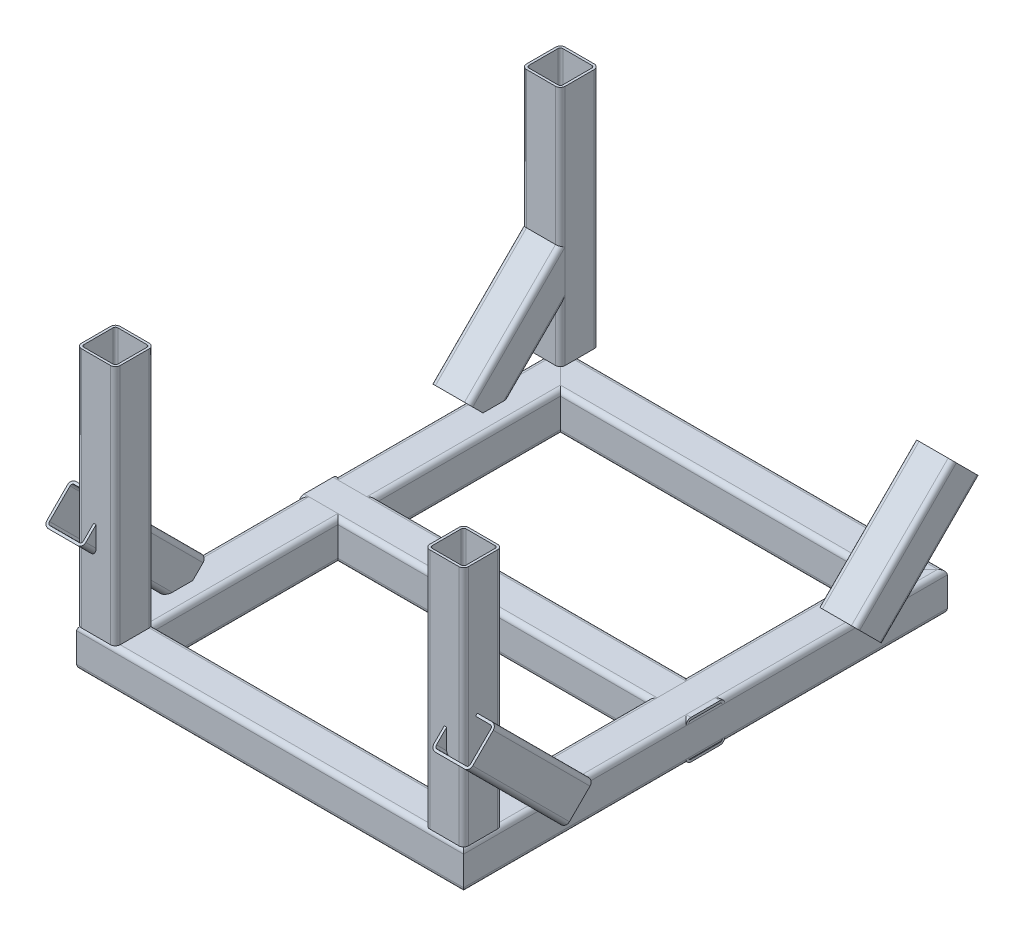
from build123d import *

# Parameters (mm, degrees)
SQUARE_TUBE_80_X_80_X_5_1_DEPTH      = 1114.13708499
SQUARE_TUBE_80_X_80_X_5_1_DEPTH_BACK = 114.13708499
SQUARE_TUBE_80_X_80_X_5_1_2_DEPTH    = 1028.27416998
SQUARE_TUBE_80_X_80_X_5_1_3_DEPTH    = 1228.27416998
SQUARE_TUBE_80_X_80_X_5_1_4_DEPTH    = 1028.27416998
SQUARE_TUBE_80_X_80_X_5_2_DEPTH      = 800
SQUARE_TUBE_80_X_80_X_5_3_DEPTH      = 500
SQUARE_TUBE_80_X_80_X_5_8_DEPTH      = 282.842712475
SQUARE_TUBE_80_X_80_X_5_8_2_DEPTH    = 282.842712475
SQUARE_TUBE_80_X_80_X_5_8_3_DEPTH    = 282.842712475
SQUARE_TUBE_80_X_80_X_5_8_4_DEPTH    = 282.842712475
SQUARE_TUBE_80_X_80_X_5_11_DEPTH     = 500
SQUARE_TUBE_80_X_80_X_5_12_DEPTH     = 500


with BuildPart() as part:
    # Sketch11 → Square tube 80 X 80 X 5(1) (new, two sides: drawn at the far end of the back side and taken through both)
    with BuildSketch(Plane(origin=(360, -40, -500), x_dir=(1, 0, 0), z_dir=(0, 0, 1)).offset(-SQUARE_TUBE_80_X_80_X_5_1_DEPTH_BACK)):
        with BuildLine():
            Line((-30, -40), (30, -40))
            ThreePointArc((30, -40), (37.071067812, -37.071067812), (40, -30))
            Line((40, -30), (40, 30))
            ThreePointArc((40, 30), (37.071067812, 37.071067812), (30, 40))
            Line((30, 40), (-30, 40))
            ThreePointArc((-30, 40), (-37.071067812, 37.071067812), (-40, 30))
            Line((-40, 30), (-40, -30))
            ThreePointArc((-40, -30), (-37.071067812, -37.071067812), (-30, -40))
        make_face()
        with BuildLine():
            Line((-30, -35), (30, -35))
            ThreePointArc((30, -35), (33.535533906, -33.535533906), (35, -30))
            Line((35, -30), (35, 30))
            ThreePointArc((35, 30), (33.535533906, 33.535533906), (30, 35))
            Line((30, 35), (-30, 35))
            ThreePointArc((-30, 35), (-33.535533906, 33.535533906), (-35, 30))
            Line((-35, 30), (-35, -30))
            ThreePointArc((-35, -30), (-33.535533906, -33.535533906), (-30, -35))
        make_face(mode=Mode.SUBTRACT)
    extrude(amount=SQUARE_TUBE_80_X_80_X_5_1_DEPTH + SQUARE_TUBE_80_X_80_X_5_1_DEPTH_BACK)

    # Square tube 80 X 80 X 5(1) mitre 1
    split(bisect_by=Plane(origin=(400, 0, -500), x_dir=(0, 1, 0), z_dir=(0.707106781, 0, 0.707106781)), keep=Keep.TOP)

    # Square tube 80 X 80 X 5(1) mitre 2
    split(bisect_by=Plane(origin=(400, 0, 500), x_dir=(0, 1, 0), z_dir=(0.707106781, 0, -0.707106781)), keep=Keep.TOP)


with BuildPart() as body_2:
    # Sketch11 on segment 2 (carried to segment 2) → Square tube 80 X 80 X 5_1 2 (new body)
    with BuildSketch(Plane(origin=(514.13708499, -40, 460), x_dir=(0, 0, 1), z_dir=(-1, 0, 0))):
        with BuildLine():
            Line((-30, -40), (30, -40))
            ThreePointArc((30, -40), (37.071067812, -37.071067812), (40, -30))
            Line((40, -30), (40, 30))
            ThreePointArc((40, 30), (37.071067812, 37.071067812), (30, 40))
            Line((30, 40), (-30, 40))
            ThreePointArc((-30, 40), (-37.071067812, 37.071067812), (-40, 30))
            Line((-40, 30), (-40, -30))
            ThreePointArc((-40, -30), (-37.071067812, -37.071067812), (-30, -40))
        make_face()
        with BuildLine():
            Line((-30, -35), (30, -35))
            ThreePointArc((30, -35), (33.535533906, -33.535533906), (35, -30))
            Line((35, -30), (35, 30))
            ThreePointArc((35, 30), (33.535533906, 33.535533906), (30, 35))
            Line((30, 35), (-30, 35))
            ThreePointArc((-30, 35), (-33.535533906, 33.535533906), (-35, 30))
            Line((-35, 30), (-35, -30))
            ThreePointArc((-35, -30), (-33.535533906, -33.535533906), (-30, -35))
        make_face(mode=Mode.SUBTRACT)
    extrude(amount=SQUARE_TUBE_80_X_80_X_5_1_2_DEPTH)

    # Square tube 80 X 80 X 5_1 2 mitre 1
    split(bisect_by=Plane(origin=(-400, 0, 500), x_dir=(0, 1, 0), z_dir=(0.707106781, 0, 0.707106781)), keep=Keep.TOP)

    # Square tube 80 X 80 X 5_1 2 mitre 2
    split(bisect_by=Plane(origin=(400, 0, 500), x_dir=(0, -1, 0), z_dir=(-0.707106781, 0, 0.707106781)), keep=Keep.TOP)


with BuildPart() as body_3:
    # Sketch11 on segment 3 (carried to segment 3) → Square tube 80 X 80 X 5_1 3 (new body)
    with BuildSketch(Plane(origin=(-360, -40, 614.13708499), x_dir=(-1, 0, 0), z_dir=(0, 0, -1))):
        with BuildLine():
            Line((-30, -40), (30, -40))
            ThreePointArc((30, -40), (37.071067812, -37.071067812), (40, -30))
            Line((40, -30), (40, 30))
            ThreePointArc((40, 30), (37.071067812, 37.071067812), (30, 40))
            Line((30, 40), (-30, 40))
            ThreePointArc((-30, 40), (-37.071067812, 37.071067812), (-40, 30))
            Line((-40, 30), (-40, -30))
            ThreePointArc((-40, -30), (-37.071067812, -37.071067812), (-30, -40))
        make_face()
        with BuildLine():
            Line((-30, -35), (30, -35))
            ThreePointArc((30, -35), (33.535533906, -33.535533906), (35, -30))
            Line((35, -30), (35, 30))
            ThreePointArc((35, 30), (33.535533906, 33.535533906), (30, 35))
            Line((30, 35), (-30, 35))
            ThreePointArc((-30, 35), (-33.535533906, 33.535533906), (-35, 30))
            Line((-35, 30), (-35, -30))
            ThreePointArc((-35, -30), (-33.535533906, -33.535533906), (-30, -35))
        make_face(mode=Mode.SUBTRACT)
    extrude(amount=SQUARE_TUBE_80_X_80_X_5_1_3_DEPTH)

    # Square tube 80 X 80 X 5_1 3 mitre 1
    split(bisect_by=Plane(origin=(-400, 0, -500), x_dir=(0, -1, 0), z_dir=(-0.707106781, 0, 0.707106781)), keep=Keep.TOP)

    # Square tube 80 X 80 X 5_1 3 mitre 2
    split(bisect_by=Plane(origin=(-400, 0, 500), x_dir=(0, -1, 0), z_dir=(-0.707106781, 0, -0.707106781)), keep=Keep.TOP)


with BuildPart() as body_4:
    # Sketch11 on segment 4 (carried to segment 4) → Square tube 80 X 80 X 5_1 4 (new body)
    with BuildSketch(Plane(origin=(-514.13708499, -40, -460), x_dir=(0, 0, -1), z_dir=(1, 0, 0))):
        with BuildLine():
            Line((-30, -40), (30, -40))
            ThreePointArc((30, -40), (37.071067812, -37.071067812), (40, -30))
            Line((40, -30), (40, 30))
            ThreePointArc((40, 30), (37.071067812, 37.071067812), (30, 40))
            Line((30, 40), (-30, 40))
            ThreePointArc((-30, 40), (-37.071067812, 37.071067812), (-40, 30))
            Line((-40, 30), (-40, -30))
            ThreePointArc((-40, -30), (-37.071067812, -37.071067812), (-30, -40))
        make_face()
        with BuildLine():
            Line((-30, -35), (30, -35))
            ThreePointArc((30, -35), (33.535533906, -33.535533906), (35, -30))
            Line((35, -30), (35, 30))
            ThreePointArc((35, 30), (33.535533906, 33.535533906), (30, 35))
            Line((30, 35), (-30, 35))
            ThreePointArc((-30, 35), (-33.535533906, 33.535533906), (-35, 30))
            Line((-35, 30), (-35, -30))
            ThreePointArc((-35, -30), (-33.535533906, -33.535533906), (-30, -35))
        make_face(mode=Mode.SUBTRACT)
    extrude(amount=SQUARE_TUBE_80_X_80_X_5_1_4_DEPTH)

    # Square tube 80 X 80 X 5_1 4 mitre 1
    split(bisect_by=Plane(origin=(-400, 0, -500), x_dir=(0, 1, 0), z_dir=(0.707106781, 0, -0.707106781)), keep=Keep.TOP)

    # Square tube 80 X 80 X 5_1 4 mitre 2
    split(bisect_by=Plane(origin=(400, 0, -500), x_dir=(0, -1, 0), z_dir=(-0.707106781, 0, -0.707106781)), keep=Keep.TOP)


with BuildPart() as body_5:
    # Sketch1 → Square tube 80 X 80 X 5(2) (new body)
    with BuildSketch(Plane(origin=(-400, -40, 0), x_dir=(0, 0, -1), z_dir=(1, 0, 0))):
        with BuildLine():
            Line((-30, -40), (30, -40))
            ThreePointArc((30, -40), (37.071067812, -37.071067812), (40, -30))
            Line((40, -30), (40, 30))
            ThreePointArc((40, 30), (37.071067812, 37.071067812), (30, 40))
            Line((30, 40), (-30, 40))
            ThreePointArc((-30, 40), (-37.071067812, 37.071067812), (-40, 30))
            Line((-40, 30), (-40, -30))
            ThreePointArc((-40, -30), (-37.071067812, -37.071067812), (-30, -40))
        make_face()
        with BuildLine():
            Line((-30, -35), (30, -35))
            ThreePointArc((30, -35), (33.535533906, -33.535533906), (35, -30))
            Line((35, -30), (35, 30))
            ThreePointArc((35, 30), (33.535533906, 33.535533906), (30, 35))
            Line((30, 35), (-30, 35))
            ThreePointArc((-30, 35), (-33.535533906, 33.535533906), (-35, 30))
            Line((-35, 30), (-35, -30))
            ThreePointArc((-35, -30), (-33.535533906, -33.535533906), (-30, -35))
        make_face(mode=Mode.SUBTRACT)
    extrude(amount=SQUARE_TUBE_80_X_80_X_5_2_DEPTH)


with BuildPart() as body_6:
    # Sketch12 → Square tube 80 X 80 X 5(3) (new body)
    with BuildSketch(Plane(origin=(-360, 0, 460), x_dir=(1, 0, 0), z_dir=(0, 1, 0))):
        with BuildLine():
            Line((-30, -40), (30, -40))
            ThreePointArc((30, -40), (37.071067812, -37.071067812), (40, -30))
            Line((40, -30), (40, 30))
            ThreePointArc((40, 30), (37.071067812, 37.071067812), (30, 40))
            Line((30, 40), (-30, 40))
            ThreePointArc((-30, 40), (-37.071067812, 37.071067812), (-40, 30))
            Line((-40, 30), (-40, -30))
            ThreePointArc((-40, -30), (-37.071067812, -37.071067812), (-30, -40))
        make_face()
        with BuildLine():
            Line((-30, -35), (30, -35))
            ThreePointArc((30, -35), (33.535533906, -33.535533906), (35, -30))
            Line((35, -30), (35, 30))
            ThreePointArc((35, 30), (33.535533906, 33.535533906), (30, 35))
            Line((30, 35), (-30, 35))
            ThreePointArc((-30, 35), (-33.535533906, 33.535533906), (-35, 30))
            Line((-35, 30), (-35, -30))
            ThreePointArc((-35, -30), (-33.535533906, -33.535533906), (-30, -35))
        make_face(mode=Mode.SUBTRACT)
    extrude(amount=SQUARE_TUBE_80_X_80_X_5_3_DEPTH)


with BuildPart() as body_7:
    # Sketch14 → Square tube 80 X 80 X 5(8) (new body)
    with BuildSketch(Plane(origin=(-400, 200, -500), x_dir=(1, 0, 0), z_dir=(0, -0.707106781186548, 0.7071067811865471))):
        with BuildLine():
            Line((-30, -40), (30, -40))
            ThreePointArc((30, -40), (37.071067812, -37.071067812), (40, -30))
            Line((40, -30), (40, 30))
            ThreePointArc((40, 30), (37.071067812, 37.071067812), (30, 40))
            Line((30, 40), (-30, 40))
            ThreePointArc((-30, 40), (-37.071067812, 37.071067812), (-40, 30))
            Line((-40, 30), (-40, -30))
            ThreePointArc((-40, -30), (-37.071067812, -37.071067812), (-30, -40))
        make_face()
        with BuildLine():
            Line((-30, -35), (30, -35))
            ThreePointArc((30, -35), (33.535533906, -33.535533906), (35, -30))
            Line((35, -30), (35, 30))
            ThreePointArc((35, 30), (33.535533906, 33.535533906), (30, 35))
            Line((30, 35), (-30, 35))
            ThreePointArc((-30, 35), (-33.535533906, 33.535533906), (-35, 30))
            Line((-35, 30), (-35, -30))
            ThreePointArc((-35, -30), (-33.535533906, -33.535533906), (-30, -35))
        make_face(mode=Mode.SUBTRACT)
    extrude(amount=SQUARE_TUBE_80_X_80_X_5_8_DEPTH)


with BuildPart() as body_8:
    # Sketch14 on segment 2 (carried to segment 2) → Square tube 80 X 80 X 5_8 2 (new body)
    with BuildSketch(Plane(origin=(400, 200, -500), x_dir=(1, 0, 0), z_dir=(0, -0.707106781, 0.707106781))):
        with BuildLine():
            Line((-30, -40), (30, -40))
            ThreePointArc((30, -40), (37.071067812, -37.071067812), (40, -30))
            Line((40, -30), (40, 30))
            ThreePointArc((40, 30), (37.071067812, 37.071067812), (30, 40))
            Line((30, 40), (-30, 40))
            ThreePointArc((-30, 40), (-37.071067812, 37.071067812), (-40, 30))
            Line((-40, 30), (-40, -30))
            ThreePointArc((-40, -30), (-37.071067812, -37.071067812), (-30, -40))
        make_face()
        with BuildLine():
            Line((-30, -35), (30, -35))
            ThreePointArc((30, -35), (33.535533906, -33.535533906), (35, -30))
            Line((35, -30), (35, 30))
            ThreePointArc((35, 30), (33.535533906, 33.535533906), (30, 35))
            Line((30, 35), (-30, 35))
            ThreePointArc((-30, 35), (-33.535533906, 33.535533906), (-35, 30))
            Line((-35, 30), (-35, -30))
            ThreePointArc((-35, -30), (-33.535533906, -33.535533906), (-30, -35))
        make_face(mode=Mode.SUBTRACT)
    extrude(amount=SQUARE_TUBE_80_X_80_X_5_8_2_DEPTH)


with BuildPart() as body_9:
    # Sketch14 on segment 3 (carried to segment 3) → Square tube 80 X 80 X 5_8 3 (new body)
    with BuildSketch(Plane(origin=(-400, 200, 500), x_dir=(1, 0, 0), z_dir=(0, -0.707106781, -0.707106781))):
        with BuildLine():
            Line((-30, -40), (30, -40))
            ThreePointArc((30, -40), (37.071067812, -37.071067812), (40, -30))
            Line((40, -30), (40, 30))
            ThreePointArc((40, 30), (37.071067812, 37.071067812), (30, 40))
            Line((30, 40), (-30, 40))
            ThreePointArc((-30, 40), (-37.071067812, 37.071067812), (-40, 30))
            Line((-40, 30), (-40, -30))
            ThreePointArc((-40, -30), (-37.071067812, -37.071067812), (-30, -40))
        make_face()
        with BuildLine():
            Line((-30, -35), (30, -35))
            ThreePointArc((30, -35), (33.535533906, -33.535533906), (35, -30))
            Line((35, -30), (35, 30))
            ThreePointArc((35, 30), (33.535533906, 33.535533906), (30, 35))
            Line((30, 35), (-30, 35))
            ThreePointArc((-30, 35), (-33.535533906, 33.535533906), (-35, 30))
            Line((-35, 30), (-35, -30))
            ThreePointArc((-35, -30), (-33.535533906, -33.535533906), (-30, -35))
        make_face(mode=Mode.SUBTRACT)
    extrude(amount=SQUARE_TUBE_80_X_80_X_5_8_3_DEPTH)


with BuildPart() as body_10:
    # Sketch14 on segment 4 (carried to segment 4) → Square tube 80 X 80 X 5_8 4 (new body)
    with BuildSketch(Plane(origin=(400, 200, 500), x_dir=(1, 0, 0), z_dir=(0, -0.707106781, -0.707106781))):
        with BuildLine():
            Line((-30, -40), (30, -40))
            ThreePointArc((30, -40), (37.071067812, -37.071067812), (40, -30))
            Line((40, -30), (40, 30))
            ThreePointArc((40, 30), (37.071067812, 37.071067812), (30, 40))
            Line((30, 40), (-30, 40))
            ThreePointArc((-30, 40), (-37.071067812, 37.071067812), (-40, 30))
            Line((-40, 30), (-40, -30))
            ThreePointArc((-40, -30), (-37.071067812, -37.071067812), (-30, -40))
        make_face()
        with BuildLine():
            Line((-30, -35), (30, -35))
            ThreePointArc((30, -35), (33.535533906, -33.535533906), (35, -30))
            Line((35, -30), (35, 30))
            ThreePointArc((35, 30), (33.535533906, 33.535533906), (30, 35))
            Line((30, 35), (-30, 35))
            ThreePointArc((-30, 35), (-33.535533906, 33.535533906), (-35, 30))
            Line((-35, 30), (-35, -30))
            ThreePointArc((-35, -30), (-33.535533906, -33.535533906), (-30, -35))
        make_face(mode=Mode.SUBTRACT)
    extrude(amount=SQUARE_TUBE_80_X_80_X_5_8_4_DEPTH)


with BuildPart() as body_11:
    # Sketch17 → Square tube 80 X 80 X 5(11) (new body)
    with BuildSketch(Plane(origin=(360, 0, 460), x_dir=(1, 0, 0), z_dir=(0, 1, 0))):
        with BuildLine():
            Line((-30, -40), (30, -40))
            ThreePointArc((30, -40), (37.071067812, -37.071067812), (40, -30))
            Line((40, -30), (40, 30))
            ThreePointArc((40, 30), (37.071067812, 37.071067812), (30, 40))
            Line((30, 40), (-30, 40))
            ThreePointArc((-30, 40), (-37.071067812, 37.071067812), (-40, 30))
            Line((-40, 30), (-40, -30))
            ThreePointArc((-40, -30), (-37.071067812, -37.071067812), (-30, -40))
        make_face()
        with BuildLine():
            Line((-30, -35), (30, -35))
            ThreePointArc((30, -35), (33.535533906, -33.535533906), (35, -30))
            Line((35, -30), (35, 30))
            ThreePointArc((35, 30), (33.535533906, 33.535533906), (30, 35))
            Line((30, 35), (-30, 35))
            ThreePointArc((-30, 35), (-33.535533906, 33.535533906), (-35, 30))
            Line((-35, 30), (-35, -30))
            ThreePointArc((-35, -30), (-33.535533906, -33.535533906), (-30, -35))
        make_face(mode=Mode.SUBTRACT)
    extrude(amount=SQUARE_TUBE_80_X_80_X_5_11_DEPTH)


with BuildPart() as body_12:
    # Sketch18 → Square tube 80 X 80 X 5(12) (new body)
    with BuildSketch(Plane(origin=(-400, 0, -500), x_dir=(1, 0, 0), z_dir=(0, 1, 0))):
        with BuildLine():
            Line((-30, -40), (30, -40))
            ThreePointArc((30, -40), (37.071067812, -37.071067812), (40, -30))
            Line((40, -30), (40, 30))
            ThreePointArc((40, 30), (37.071067812, 37.071067812), (30, 40))
            Line((30, 40), (-30, 40))
            ThreePointArc((-30, 40), (-37.071067812, 37.071067812), (-40, 30))
            Line((-40, 30), (-40, -30))
            ThreePointArc((-40, -30), (-37.071067812, -37.071067812), (-30, -40))
        make_face()
        with BuildLine():
            Line((-30, -35), (30, -35))
            ThreePointArc((30, -35), (33.535533906, -33.535533906), (35, -30))
            Line((35, -30), (35, 30))
            ThreePointArc((35, 30), (33.535533906, 33.535533906), (30, 35))
            Line((30, 35), (-30, 35))
            ThreePointArc((-30, 35), (-33.535533906, 33.535533906), (-35, 30))
            Line((-35, 30), (-35, -30))
            ThreePointArc((-35, -30), (-33.535533906, -33.535533906), (-30, -35))
        make_face(mode=Mode.SUBTRACT)
    extrude(amount=SQUARE_TUBE_80_X_80_X_5_12_DEPTH)


solid = Compound([part.part, body_2.part, body_3.part, body_4.part, body_5.part, body_6.part, body_7.part, body_8.part, body_9.part, body_10.part, body_11.part, body_12.part])
